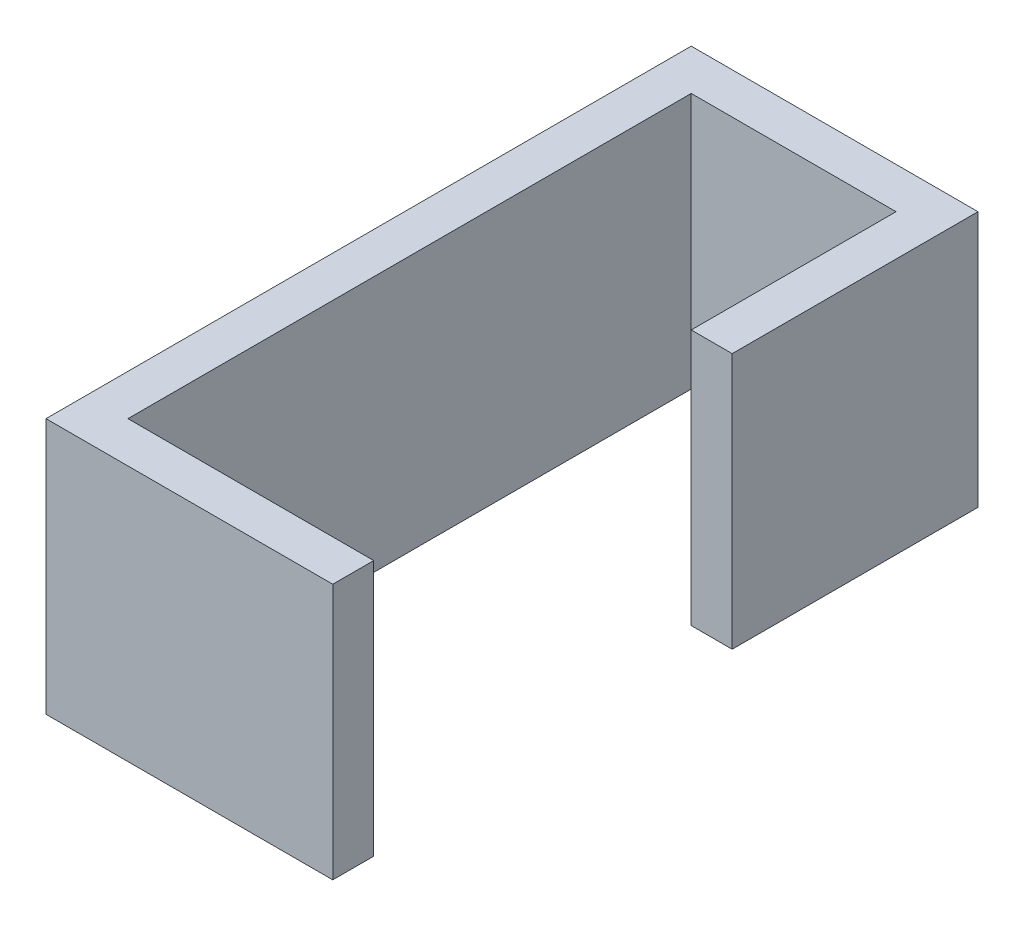
from build123d import *

# Parameters (mm, degrees)
BOSS_EXTRUDE1_DEPTH = 25


with BuildPart() as part:
    # Sketch1 → Boss-Extrude1 (new body)
    with BuildSketch(Plane(origin=(0, 0, 0), x_dir=(1, 0, 0), z_dir=(0, 1, 0))):
        Polygon((0, 0), (0, 63), (28, 63), (28, 39), (24, 39), (24, 59), (4, 59), (4, 4), (28, 4), (28, 0), align=None)
    extrude(amount=BOSS_EXTRUDE1_DEPTH)


solid = part.part
